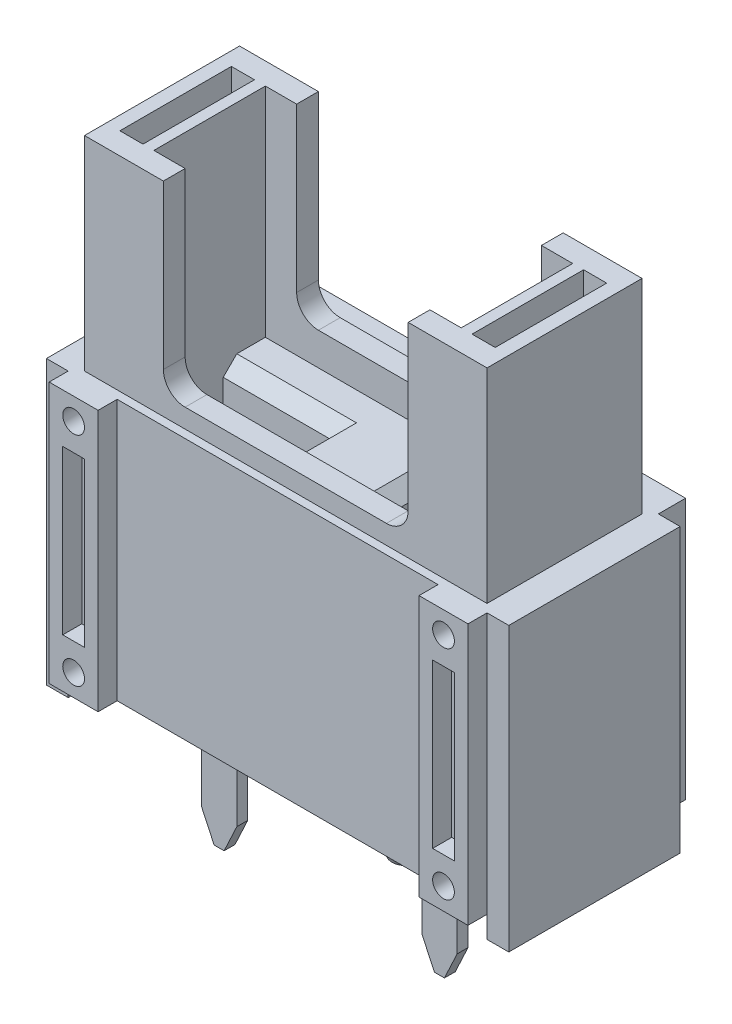
from build123d import *
from OCP.BRepFilletAPI import BRepFilletAPI_MakeChamfer

# Parameters (mm, degrees)
BOSS_EXTRUDE1_DEPTH = 10.4
SKETCH2_W           = 15.4
SKETCH2_H           = 10.496650932
CUT_EXTRUDE1_DEPTH  = 0.8
SKETCH3_W           = 14.8
SKETCH3_H           = 5.7
BOSS_EXTRUDE2_DEPTH = 7.5
CUT_EXTRUDE2_DEPTH  = 26.659501164
SKETCH5_W           = 11.3
SKETCH5_H           = 4.1
CUT_EXTRUDE3_DEPTH  = 8
SKETCH6_W           = 0.85
SKETCH6_H           = 4.1
CUT_EXTRUDE4_DEPTH  = 8
SKETCH7_R           = 0.4
SKETCH7_W           = 0.8
SKETCH7_H           = 6
CUT_EXTRUDE5_DEPTH  = 0.7
SKETCH8_R           = 1.19
BOSS_EXTRUDE3_DEPTH = 4.3
SKETCH9_R           = 2.149416558
SKETCH9_R_2         = 1.05
CUT_EXTRUDE6_DEPTH  = 2.3
CHAMFER1_SIZE       = 1.5
CHAMFER1_SIZE2      = 0.699461487
SKETCH10_W          = 3.754063744
SKETCH10_H          = 0.4
CUT_EXTRUDE7_DEPTH  = 4
SKETCH11_W          = 1.3
SKETCH11_H          = 0.4
BOSS_EXTRUDE4_DEPTH = 4.71
CHAMFER2_SIZE       = 1
CHAMFER2_SIZE2      = 0.466307658
FILLET1_R           = 0.3
CUT_EXTRUDE8_DEPTH  = 0.05
BOSS_EXTRUDE5_DEPTH = 0.05
CUT_EXTRUDE10_DEPTH = 0.03
SKETCH15_R          = 1.45
SKETCH15_R_2        = 1.15
CUT_EXTRUDE11_DEPTH = 0.1
SKETCH16_W          = 3.9
SKETCH16_H          = 1
CUT_EXTRUDE12_DEPTH = 8
CHAMFER3_SIZE       = 0.5


with BuildPart() as part:
    # Sketch1 → Boss-Extrude1 (new body)
    with BuildSketch(Plane(origin=(0, 0, 0), x_dir=(1, 0, 0), z_dir=(0, 1, 0))):
        Polygon((0, 0), (0, 6.3), (0.8, 6.3), (0.8, 7.3), (16.2, 7.3), (16.2, 6.3), (17, 6.3), (17, 0), (16.2, 0), (16.2, -0.7), (14.4, -0.7), (14.4, 0), (2.6, 0), (2.6, -0.7), (0.8, -0.7), (0.8, 0), align=None)
    extrude(amount=BOSS_EXTRUDE1_DEPTH)

    # Sketch2 → Cut-Extrude1 (cut)
    with BuildSketch(Plane.XZ):
        with Locations((8.5, -3.67488039)):
            Rectangle(SKETCH2_W, SKETCH2_H)
    extrude(amount=-CUT_EXTRUDE1_DEPTH, mode=Mode.SUBTRACT)

    # Sketch3 → Boss-Extrude2 (add)
    with BuildSketch(Plane(origin=(0, 10.4, 0), x_dir=(1, 0, 0), z_dir=(0, 1, 0))):
        with Locations((8.5, 3.15)):
            Rectangle(SKETCH3_W, SKETCH3_H)
    extrude(amount=BOSS_EXTRUDE2_DEPTH)

    # Sketch4 → Cut-Extrude2 (cut, through all)
    with BuildSketch(Plane.XY.offset(-0.3)):
        with BuildLine():
            Line((4, 17.9), (4, 11.9))
            ThreePointArc((4, 11.9), (4.234314575, 11.334314575), (4.8, 11.1))
            Line((4.8, 11.1), (12.2, 11.1))
            ThreePointArc((12.2, 11.1), (12.765685425, 11.334314575), (13, 11.9))
            Line((13, 11.9), (13, 17.9))
            Line((13, 17.9), (4, 17.9))
        make_face()
    extrude(amount=-CUT_EXTRUDE2_DEPTH, mode=Mode.SUBTRACT)

    # Sketch5 → Cut-Extrude3 (cut)
    with BuildSketch(Plane(origin=(0, 17.9, 0), x_dir=(1, 0, 0), z_dir=(0, 1, 0))):
        with Locations((8.5, 3.15)):
            Rectangle(SKETCH5_W, SKETCH5_H)
    extrude(amount=-CUT_EXTRUDE3_DEPTH, mode=Mode.SUBTRACT)

    # Sketch6 → Cut-Extrude4 (cut)
    with BuildSketch(Plane(origin=(0, 17.9, 0), x_dir=(1, 0, 0), z_dir=(0, 1, 0))):
        with Locations((14.975, 3.15)):
            Rectangle(SKETCH6_W, SKETCH6_H)
        with Locations((2.025, 3.15)):
            Rectangle(SKETCH6_W, SKETCH6_H)
    extrude(amount=-CUT_EXTRUDE4_DEPTH, mode=Mode.SUBTRACT)

    # Sketch7 → Cut-Extrude5 (cut)
    with BuildSketch(Plane.XY.offset(0.7)):
        with Locations((15.3, 9.6)):
            Circle(SKETCH7_R)
        with Locations((15.3, 1.6)):
            Circle(SKETCH7_R)
        with Locations(Location((1.7, 1.6, 0), (0, 0, 180))):
            Circle(SKETCH7_R)
        with Locations(Location((1.7, 9.6, 0), (0, 0, 180))):
            Circle(SKETCH7_R)
        with Locations((15.3, 5.6)):
            Rectangle(SKETCH7_W, SKETCH7_H)
        with Locations((1.7, 5.6)):
            Rectangle(SKETCH7_W, SKETCH7_H)
    extrude(amount=-CUT_EXTRUDE5_DEPTH, mode=Mode.SUBTRACT)

    # Sketch8 → Boss-Extrude3 (add)
    with BuildSketch(Plane.XZ.offset(-0.8)):
        with Locations(Location((8.5, -4.7, 0), (0, 0, 90))):
            Circle(SKETCH8_R)
    extrude(amount=BOSS_EXTRUDE3_DEPTH)

    # Sketch9 → Cut-Extrude6 (cut)
    with BuildSketch(Plane.XZ.offset(-0.8)):
        with Locations((8.5, -4.7)):
            Circle(SKETCH9_R)
        with Locations(Location((8.5, -4.7, 0), (0, 0, 270))):
            Circle(SKETCH9_R_2, mode=Mode.SUBTRACT)
    extrude(amount=CUT_EXTRUDE6_DEPTH, mode=Mode.SUBTRACT)

    # Chamfer1
    chamfer1_edges = [part.edges().sort_by_distance(p)[0] for p in [
        (8.5, -3.5, -5.89),
    ]]
    chamfer1_side = [part.faces().sort_by_distance(p)[0] for p in [
        (8.5, -2.5, -5.89),
    ]]
    chamfer(chamfer1_edges, length=CHAMFER1_SIZE, length2=CHAMFER1_SIZE2, reference=chamfer1_side[0])

    # Sketch10 → Cut-Extrude7 (cut)
    with BuildSketch(Plane.XZ.offset(3.5)):
        with Locations((8.5, -4.7)):
            Rectangle(SKETCH10_W, SKETCH10_H)
    extrude(amount=-CUT_EXTRUDE7_DEPTH, mode=Mode.SUBTRACT)

    # Sketch11 → Boss-Extrude4 (add)
    with BuildSketch(Plane.XZ.offset(-0.8)):
        with Locations((12.55, -2.1)):
            Rectangle(SKETCH11_W, SKETCH11_H)
        with Locations((4.45, -2.1)):
            Rectangle(SKETCH11_W, SKETCH11_H)
    extrude(amount=BOSS_EXTRUDE4_DEPTH)

    # Chamfer2: one chamfer whose edges measure the first distance from different faces: ONE call of the kernel's chamfer builder (chamfer() names one face for all edges)
    chamfer2_edges_1 = [part.edges().sort_by_distance(p)[0] for p in [
        (13.2, -3.91, -2.1),
    ]]
    chamfer2_side_1 = [part.faces().sort_by_distance(p)[0] for p in [
        (13.2, -1.555, -2.1),
    ]]
    chamfer2_edges_2 = [part.edges().sort_by_distance(p)[0] for p in [
        (11.9, -3.91, -2.1),
    ]]
    chamfer2_side_2 = [part.faces().sort_by_distance(p)[0] for p in [
        (11.9, -1.555, -2.1),
    ]]
    chamfer2_edges_3 = [part.edges().sort_by_distance(p)[0] for p in [
        (5.1, -3.91, -2.1),
    ]]
    chamfer2_side_3 = [part.faces().sort_by_distance(p)[0] for p in [
        (5.1, -1.555, -2.1),
    ]]
    chamfer2_edges_4 = [part.edges().sort_by_distance(p)[0] for p in [
        (3.8, -3.91, -2.1),
    ]]
    chamfer2_side_4 = [part.faces().sort_by_distance(p)[0] for p in [
        (3.8, -1.555, -2.1),
    ]]
    chamfer2 = BRepFilletAPI_MakeChamfer(part.part.solid().wrapped)
    for e in chamfer2_edges_1:
        chamfer2.Add(CHAMFER2_SIZE, CHAMFER2_SIZE2, e.wrapped, chamfer2_side_1[0].wrapped)  # the first distance lies on this face
    for e in chamfer2_edges_2:
        chamfer2.Add(CHAMFER2_SIZE, CHAMFER2_SIZE2, e.wrapped, chamfer2_side_2[0].wrapped)  # the first distance lies on this face
    for e in chamfer2_edges_3:
        chamfer2.Add(CHAMFER2_SIZE, CHAMFER2_SIZE2, e.wrapped, chamfer2_side_3[0].wrapped)  # the first distance lies on this face
    for e in chamfer2_edges_4:
        chamfer2.Add(CHAMFER2_SIZE, CHAMFER2_SIZE2, e.wrapped, chamfer2_side_4[0].wrapped)  # the first distance lies on this face
    add(Compound.cast(chamfer2.Shape()), mode=Mode.REPLACE)

    # Fillet1
    fillet1_edges = [part.edges().sort_by_distance(p)[0] for p in [
        (13.2, 0.8, -2.1),
        (11.9, 0.8, -2.1),
        (5.1, 0.8, -2.1),
        (3.8, 0.8, -2.1),
    ]]
    fillet(fillet1_edges, radius=FILLET1_R)

    # Sketch12 → Cut-Extrude8 (cut)
    with BuildSketch(Plane(origin=(0, 0, -7.3), x_dir=(-1, 0, 0), z_dir=(0, 0, -1))):
        with BuildLine():
            Line((-12, 8.35), (-5, 8.35))
            ThreePointArc((-5, 8.35), (-4.646446609, 8.203553391), (-4.5, 7.85))
            Line((-4.5, 7.85), (-4.5, 3.35))
            ThreePointArc((-4.5, 3.35), (-4.646446609, 2.996446609), (-5, 2.85))
            Line((-5, 2.85), (-12, 2.85))
            ThreePointArc((-12, 2.85), (-12.353553391, 2.996446609), (-12.5, 3.35))
            Line((-12.5, 3.35), (-12.5, 7.85))
            ThreePointArc((-12.5, 7.85), (-12.353553391, 8.203553391), (-12, 8.35))
        make_face()
    extrude(amount=-CUT_EXTRUDE8_DEPTH, mode=Mode.SUBTRACT)

    # Sketch13 → Boss-Extrude5 (add)
    # profile 1 of 9: a face of its own
    with BuildSketch(Plane(origin=(0, 0, -7.25), x_dir=(-1, 0, 0), z_dir=(0, 0, -1))):
        with BuildLine():
            Line((-11.867863065, 6.901428283), (-11.962841698, 6.901428283))
            add(Edge.make_bspline(
                [(-11.962841698, 6.901428283), (-11.960268572, 6.912081915), (-11.955238321, 6.932908894), (-11.944746436, 6.962665376), (-11.933316661, 6.990824155), (-11.91959186, 7.016857968), (-11.904621356, 7.041290017), (-11.887469485, 7.063566157), (-11.868927569, 7.084252934), (-11.848418596, 7.102611461), (-11.826910644, 7.119235679), (-11.804100652, 7.133409804), (-11.780447539, 7.145603059), (-11.755787425, 7.155648225), (-11.730046892, 7.163215466), (-11.703458649, 7.168705739), (-11.675953019, 7.172271147), (-11.657281724, 7.172619116), (-11.647800966, 7.172795805)],
                knots=[0, 0, 0, 0, 1.162005537, 2.271625781, 3.343758855, 4.383309926, 5.390229558, 6.379919256, 7.361854164, 8.333198761, 9.295911338, 10.242430842, 11.177959212, 12.116337295, 13.062827104, 14.020064771, 14.994644689, 16, 16, 16, 16], degree=3))
            add(Edge.make_bspline(
                [(-11.647800966, 7.172795805), (-11.633987375, 7.172378752), (-11.606661507, 7.171553743), (-11.566516491, 7.164020092), (-11.527803619, 7.152098683), (-11.490946632, 7.135626865), (-11.456711535, 7.115310701), (-11.426250831, 7.091130888), (-11.3999774, 7.063553957), (-11.377935529, 7.033094348), (-11.360677136, 7.000541372), (-11.347951019, 6.967037515), (-11.34020351, 6.932662252), (-11.339199437, 6.909452313), (-11.338696399, 6.897824183)],
                knots=[0, 0, 0, 0, 1.083050992, 2.142477498, 3.193116406, 4.255571735, 5.30263384, 6.308962982, 7.297363603, 8.282367274, 9.249857812, 10.179914175, 11.08814088, 12, 12, 12, 12], degree=3))
            add(Edge.make_bspline(
                [(-11.338696399, 6.897824183), (-11.339048246, 6.886634033), (-11.339736758, 6.864736647), (-11.345582902, 6.83276848), (-11.355421248, 6.802638758), (-11.369049486, 6.774220644), (-11.38669086, 6.747694324), (-11.408060937, 6.723000114), (-11.433310551, 6.700028488), (-11.452444897, 6.686869028), (-11.462295824, 6.680094149)],
                knots=[0, 0, 0, 0, 1.024540389, 2.004866551, 2.965041327, 3.920577974, 4.882998113, 5.874504559, 6.905732034, 8, 8, 8, 8], degree=3))
            add(Edge.make_bspline(
                [(-11.462295824, 6.680094149), (-11.451037651, 6.674657892), (-11.428731953, 6.663887095), (-11.398327388, 6.642764045), (-11.370726698, 6.618375102), (-11.355334383, 6.599342442), (-11.347600645, 6.589779645)],
                knots=[0, 0, 0, 0, 1.015518401, 2.012035669, 3.001164323, 4, 4, 4, 4], degree=3))
            add(Edge.make_bspline(
                [(-11.347600645, 6.589779645), (-11.342508144, 6.58280742), (-11.332406535, 6.568977146), (-11.319937695, 6.546741131), (-11.308625892, 6.524258657), (-11.299811421, 6.500927122), (-11.292985513, 6.477016949), (-11.288106284, 6.452487082), (-11.285075175, 6.427317489), (-11.284641092, 6.410289668), (-11.284422894, 6.401730433)],
                knots=[0, 0, 0, 0, 1.025084078, 2.033381695, 3.024893161, 4.013698104, 4.991890475, 5.976764909, 6.982997093, 8, 8, 8, 8], degree=3))
            add(Edge.make_bspline(
                [(-11.284422894, 6.401730433), (-11.284965521, 6.386910827), (-11.286048221, 6.357341356), (-11.295725643, 6.313654952), (-11.310727742, 6.27095105), (-11.332032578, 6.230106992), (-11.357997277, 6.191891972), (-11.388887706, 6.15769985), (-11.424352882, 6.128308843), (-11.463906018, 6.103752417), (-11.506758579, 6.084122474), (-11.552592151, 6.070497961), (-11.600746334, 6.06162429), (-11.63376854, 6.060672737), (-11.650557042, 6.060188967)],
                knots=[0, 0, 0, 0, 0.955779014, 1.907060117, 2.875433937, 3.871313158, 4.872415639, 5.851225146, 6.836215519, 7.83643374, 8.849228613, 9.86973379, 10.916971861, 12, 12, 12, 12], degree=3))
            add(Edge.make_bspline(
                [(-11.650557042, 6.060188967), (-11.661871926, 6.060451498), (-11.684135844, 6.060968072), (-11.716866616, 6.064499458), (-11.74810913, 6.070949246), (-11.777905627, 6.079628578), (-11.806282579, 6.090632748), (-11.833153392, 6.104336259), (-11.858683383, 6.120456642), (-11.882631638, 6.139184179), (-11.9049953, 6.160133537), (-11.925180052, 6.183676618), (-11.943522418, 6.209378214), (-11.959531263, 6.237536853), (-11.973935771, 6.267788633), (-11.985783346, 6.300520917), (-11.996211125, 6.335441085), (-12.001059339, 6.359776021), (-12.003546826, 6.372261616)],
                knots=[0, 0, 0, 0, 1.048658725, 2.063410685, 3.046034179, 4.001477787, 4.936774919, 5.862367409, 6.792675028, 7.730719943, 8.675894397, 9.627829632, 10.600096036, 11.597688215, 12.626045268, 13.701542398, 14.82072376, 16, 16, 16, 16], degree=3))
            Line((-12.003546826, 6.372261616), (-11.908568194, 6.372261616))
            add(Edge.make_bspline(
                [(-11.908568194, 6.372261616), (-11.906093722, 6.364112748), (-11.90128066, 6.348262492), (-11.893087861, 6.32545078), (-11.883753883, 6.304538702), (-11.873740671, 6.285372853), (-11.863224332, 6.267764484), (-11.851457199, 6.252179204), (-11.839310815, 6.237932465), (-11.830154915, 6.22990588), (-11.825673896, 6.225977562)],
                knots=[0, 0, 0, 0, 1.198163088, 2.33053128, 3.407730985, 4.417276592, 5.372219308, 6.28897303, 7.162600585, 8, 8, 8, 8], degree=3))
            add(Edge.make_bspline(
                [(-11.825673896, 6.225977562), (-11.819748265, 6.22140909), (-11.807915293, 6.212286247), (-11.788632994, 6.200644088), (-11.76835385, 6.190556349), (-11.74663846, 6.182850565), (-11.723955423, 6.176325891), (-11.6999381, 6.172056115), (-11.674798385, 6.169126597), (-11.657632894, 6.168868082), (-11.648860995, 6.168735975)],
                knots=[0, 0, 0, 0, 0.946170439, 1.889420265, 2.845303464, 3.807233317, 4.801018734, 5.828864929, 6.890507805, 8, 8, 8, 8], degree=3))
            add(Edge.make_bspline(
                [(-11.648860995, 6.168735975), (-11.63895696, 6.168922213), (-11.619590474, 6.169286386), (-11.591331505, 6.172635469), (-11.564447586, 6.177512998), (-11.539237201, 6.18504621), (-11.515370119, 6.194353753), (-11.493180906, 6.206040295), (-11.472378274, 6.219751675), (-11.453228668, 6.235336135), (-11.436009431, 6.25239692), (-11.420848198, 6.270241349), (-11.407959312, 6.288794183), (-11.397562373, 6.308158091), (-11.389352563, 6.328252886), (-11.383763596, 6.349134961), (-11.379877542, 6.37063342), (-11.379561067, 6.38524718), (-11.379401527, 6.392614181)],
                knots=[0, 0, 0, 0, 1.217147791, 2.380027433, 3.494444702, 4.572153297, 5.609568379, 6.639424714, 7.649109417, 8.668170816, 9.669597737, 10.625200337, 11.543417969, 12.441394052, 13.322311151, 14.205496177, 15.095365482, 16, 16, 16, 16], degree=3))
            add(Edge.make_bspline(
                [(-11.379401527, 6.392614181), (-11.379864261, 6.402475228), (-11.380787426, 6.422148256), (-11.387835497, 6.451091428), (-11.399428439, 6.478978031), (-11.415657984, 6.505332282), (-11.435414264, 6.529757376), (-11.458505557, 6.551550419), (-11.485123617, 6.569533042), (-11.509622482, 6.581957469), (-11.531322898, 6.590435347), (-11.549893741, 6.5960823), (-11.570684428, 6.600864049), (-11.593443538, 6.605312759), (-11.618342559, 6.609098976), (-11.645354381, 6.612256383), (-11.674484481, 6.614782788), (-11.694650619, 6.615911), (-11.705042553, 6.616492386)],
                knots=[0, 0, 0, 0, 1.07054697, 2.135767047, 3.216561865, 4.33974944, 5.486079747, 6.621378074, 7.775625952, 8.963672916, 9.598146892, 10.304877434, 11.070270905, 11.915000392, 12.823868403, 13.805723172, 14.86925407, 16, 16, 16, 16], degree=3))
            Line((-11.705042553, 6.616492386), (-11.705042553, 6.725039394))
            add(Edge.make_bspline(
                [(-11.705042553, 6.725039394), (-11.691949105, 6.725261585), (-11.666302257, 6.725696802), (-11.628838979, 6.730960653), (-11.593014906, 6.738242176), (-11.559623963, 6.749395555), (-11.529189709, 6.762349645), (-11.502785925, 6.777424004), (-11.480782525, 6.794180368), (-11.463286439, 6.812877372), (-11.45012403, 6.832929779), (-11.440500213, 6.85382934), (-11.434815352, 6.875759234), (-11.434056477, 6.890725479), (-11.433675031, 6.898248195)],
                knots=[0, 0, 0, 0, 1.321986639, 2.589447074, 3.816329219, 5.01088745, 6.139805852, 7.153945165, 8.075214402, 8.924034688, 9.728124013, 10.488707548, 11.240355623, 12, 12, 12, 12], degree=3))
            add(Edge.make_bspline(
                [(-11.433675031, 6.898248195), (-11.433800341, 6.903775037), (-11.434049639, 6.914770427), (-11.437193578, 6.930834436), (-11.441917991, 6.946407341), (-11.448413052, 6.961422917), (-11.457106564, 6.975777024), (-11.467510279, 6.989592038), (-11.479898252, 7.002789085), (-11.494093661, 7.015090039), (-11.509337231, 7.026813118), (-11.52604371, 7.036765575), (-11.543709372, 7.045276106), (-11.562353775, 7.052294217), (-11.582037424, 7.057573573), (-11.602667835, 7.061364173), (-11.624284349, 7.06373413), (-11.639031992, 7.064075342), (-11.646528931, 7.064248796)],
                knots=[0, 0, 0, 0, 0.884392785, 1.759457502, 2.611959086, 3.489218968, 4.37281399, 5.2945488, 6.255912374, 7.266815255, 8.301784654, 9.332968512, 10.37626691, 11.440494194, 12.520033166, 13.637162961, 14.798855837, 16, 16, 16, 16], degree=3))
            add(Edge.make_bspline(
                [(-11.646528931, 7.064248796), (-11.658579316, 7.063828075), (-11.682116521, 7.063006308), (-11.716048175, 7.05580873), (-11.747592354, 7.044324881), (-11.771703808, 7.030617039), (-11.789508777, 7.017085361), (-11.802232042, 7.005267591), (-11.814726577, 6.992134333), (-11.826170389, 6.976876681), (-11.83774371, 6.960527914), (-11.848280042, 6.942256943), (-11.858518568, 6.922540376), (-11.86468791, 6.908601935), (-11.867863065, 6.901428283)],
                knots=[0, 0, 0, 0, 1.472543308, 2.876219568, 4.221790263, 5.565193594, 6.249813518, 6.953379497, 7.687249741, 8.463570142, 9.283606569, 10.136032583, 11.040678096, 12, 12, 12, 12], degree=3))
        make_face()
    # profile 2 of 9: a face of its own
    with BuildSketch(Plane(origin=(0, 0, -7.25), x_dir=(-1, 0, 0), z_dir=(0, 0, -1))):
        with BuildLine():
            Line((-11.053760501, 6.820018027), (-11.148739134, 6.820018027))
            add(Edge.make_bspline(
                [(-11.148739134, 6.820018027), (-11.148120114, 6.832618509), (-11.146904375, 6.857365522), (-11.141211059, 6.893446799), (-11.133064651, 6.927934797), (-11.12154652, 6.960552605), (-11.107242003, 6.991588625), (-11.090087923, 7.020919582), (-11.069769783, 7.048433584), (-11.046726318, 7.073875568), (-11.021698658, 7.097215619), (-10.994694243, 7.117370895), (-10.966317294, 7.134400286), (-10.936653905, 7.148636757), (-10.905369401, 7.159322853), (-10.87274768, 7.167251777), (-10.838645417, 7.172022244), (-10.815410458, 7.172535017), (-10.803593567, 7.172795805)],
                knots=[0, 0, 0, 0, 1.10065271, 2.161652631, 3.183658789, 4.190468796, 5.17591951, 6.163126047, 7.15150782, 8.156236427, 9.156009102, 10.134482811, 11.092018607, 12.041330605, 13.001268258, 13.972401359, 14.968799086, 16, 16, 16, 16], degree=3))
            add(Edge.make_bspline(
                [(-10.803593567, 7.172795805), (-10.791988769, 7.172524128), (-10.769185754, 7.171990295), (-10.735905097, 7.167405888), (-10.704222439, 7.160225673), (-10.67419971, 7.150151726), (-10.646076448, 7.136609768), (-10.619641384, 7.120342417), (-10.594579806, 7.101528325), (-10.572020135, 7.079377768), (-10.551304597, 7.055730856), (-10.533433201, 7.030485704), (-10.518128744, 7.004411611), (-10.505371993, 6.97730975), (-10.495981209, 6.948924939), (-10.488851608, 6.919670428), (-10.484821652, 6.889243401), (-10.484203154, 6.868649276), (-10.483888706, 6.858179084)],
                knots=[0, 0, 0, 0, 1.111607364, 2.184268762, 3.212621178, 4.221274766, 5.211760367, 6.196651075, 7.1921475, 8.207485113, 9.220403448, 10.201281604, 11.166441695, 12.114753415, 13.065576456, 14.026450734, 14.996634279, 16, 16, 16, 16], degree=3))
            add(Edge.make_bspline(
                [(-10.483888706, 6.858179084), (-10.484400717, 6.843438668), (-10.485415753, 6.814216508), (-10.494098433, 6.771273918), (-10.507659164, 6.729668289), (-10.523986936, 6.696183439), (-10.540458366, 6.66920093), (-10.555301493, 6.646985393), (-10.572677757, 6.623065406), (-10.592840065, 6.597521068), (-10.615371338, 6.570152294), (-10.640475659, 6.540975618), (-10.668332045, 6.510292488), (-10.687883544, 6.489335794), (-10.698014641, 6.47847656)],
                knots=[0, 0, 0, 0, 1.184426356, 2.348067706, 3.509069118, 4.696110526, 5.333549288, 6.050745305, 6.844228056, 7.710549037, 8.667450064, 9.695053472, 10.805634456, 12, 12, 12, 12], degree=3))
            Line((-10.698014641, 6.47847656), (-10.96280998, 6.195872728))
            Line((-10.96280998, 6.195872728), (-10.47032033, 6.195872728))
            Line((-10.47032033, 6.195872728), (-10.47032033, 6.087325719))
            Line((-10.47032033, 6.087325719), (-11.189444262, 6.087325719))
            Line((-11.189444262, 6.087325719), (-10.779000886, 6.525329859))
            add(Edge.make_bspline(
                [(-10.779000886, 6.525329859), (-10.769007834, 6.53576149), (-10.749813228, 6.555798518), (-10.722664687, 6.585051746), (-10.698280992, 6.612190298), (-10.676504305, 6.637162897), (-10.65780703, 6.660334823), (-10.641214713, 6.680955603), (-10.627920355, 6.699931353), (-10.613492129, 6.721926729), (-10.599517901, 6.748781882), (-10.587509641, 6.781600403), (-10.580187532, 6.815384596), (-10.579309165, 6.838214974), (-10.578867339, 6.849698849)],
                knots=[0, 0, 0, 0, 1.329631726, 2.553950428, 3.673215718, 4.687767853, 5.603093632, 6.413772471, 7.123043292, 7.734684054, 8.834405432, 9.900288307, 10.943827018, 12, 12, 12, 12], degree=3))
            add(Edge.make_bspline(
                [(-10.578867339, 6.849698849), (-10.579059575, 6.856920129), (-10.579438436, 6.871151886), (-10.582782073, 6.892017913), (-10.587835012, 6.912145844), (-10.595075602, 6.931597594), (-10.604632878, 6.950177588), (-10.616266495, 6.967908446), (-10.629689205, 6.985050109), (-10.645216851, 7.001122654), (-10.66227462, 7.015842923), (-10.680294786, 7.028882825), (-10.699359936, 7.039780366), (-10.719389688, 7.048713756), (-10.740328199, 7.05572155), (-10.762215967, 7.060577359), (-10.784992515, 7.06362611), (-10.800545024, 7.06403861), (-10.808469703, 7.064248796)],
                knots=[0, 0, 0, 0, 0.991446411, 1.95395049, 2.89581595, 3.838931463, 4.798493298, 5.75982156, 6.748411868, 7.785213223, 8.824556874, 9.840280684, 10.836137867, 11.835679398, 12.848801643, 13.863922112, 14.911575587, 16, 16, 16, 16], degree=3))
            add(Edge.make_bspline(
                [(-10.808469703, 7.064248796), (-10.816746121, 7.064032584), (-10.83299964, 7.063607979), (-10.856863253, 7.060637792), (-10.879628238, 7.055513693), (-10.901351861, 7.048505508), (-10.922070879, 7.039597804), (-10.94168453, 7.028502919), (-10.960148785, 7.015263625), (-10.977498352, 7.000253266), (-10.993483413, 6.983541396), (-11.007528063, 6.964911717), (-11.019799896, 6.94470438), (-11.030506974, 6.922973908), (-11.039202147, 6.899523123), (-11.045846409, 6.874435269), (-11.05110386, 6.84781928), (-11.052860246, 6.829439028), (-11.053760501, 6.820018027)],
                knots=[0, 0, 0, 0, 1.031018746, 2.02475058, 2.990194455, 3.934040569, 4.864654155, 5.795059489, 6.735614925, 7.690564532, 8.649604399, 9.611025574, 10.590972636, 11.591080095, 12.624614302, 13.701020113, 14.821632451, 16, 16, 16, 16], degree=3))
        make_face()
    # profile 3 of 9: a face of its own
    with BuildSketch(Plane(origin=(0, 0, -7.25), x_dir=(-1, 0, 0), z_dir=(0, 0, -1))):
        Polygon((-10.361773322, 7.145659052), (-10.260010501, 7.145659052), (-9.907232723, 6.311627936), (-9.554454946, 7.145659052), (-9.452692125, 7.145659052), (-9.900448535, 6.087325719), (-9.914016911, 6.087325719), align=None)
    # profile 4 of 9: a face of its own
    with BuildSketch(Plane(origin=(0, 0, -7.25), x_dir=(-1, 0, 0), z_dir=(0, 0, -1))):
        with BuildLine():
            Line((-7.593824604, 6.820018027), (-7.688803236, 6.820018027))
            add(Edge.make_bspline(
                [(-7.688803236, 6.820018027), (-7.688184216, 6.832618509), (-7.686968477, 6.857365522), (-7.681275161, 6.893446799), (-7.673128753, 6.927934797), (-7.661610623, 6.960552605), (-7.647306106, 6.991588625), (-7.630152026, 7.020919582), (-7.609833885, 7.048433584), (-7.586790421, 7.073875568), (-7.561762761, 7.097215619), (-7.534758346, 7.117370895), (-7.506381397, 7.134400286), (-7.476718007, 7.148636757), (-7.445433504, 7.159322853), (-7.412811782, 7.167251777), (-7.37870952, 7.172022244), (-7.35547456, 7.172535017), (-7.34365767, 7.172795805)],
                knots=[0, 0, 0, 0, 1.10065271, 2.161652631, 3.183658789, 4.190468796, 5.17591951, 6.163126047, 7.15150782, 8.156236427, 9.156009102, 10.134482811, 11.092018607, 12.041330605, 13.001268258, 13.972401359, 14.968799086, 16, 16, 16, 16], degree=3))
            add(Edge.make_bspline(
                [(-7.34365767, 7.172795805), (-7.332052871, 7.172524128), (-7.309249857, 7.171990295), (-7.2759692, 7.167405888), (-7.244286542, 7.160225673), (-7.214263813, 7.150151726), (-7.18614055, 7.136609768), (-7.159705487, 7.120342417), (-7.134643908, 7.101528325), (-7.112084238, 7.079377768), (-7.0913687, 7.055730856), (-7.073497303, 7.030485704), (-7.058192847, 7.004411611), (-7.045436096, 6.97730975), (-7.036045311, 6.948924939), (-7.02891571, 6.919670428), (-7.024885754, 6.889243401), (-7.024267257, 6.868649276), (-7.023952809, 6.858179084)],
                knots=[0, 0, 0, 0, 1.111607364, 2.184268762, 3.212621178, 4.221274766, 5.211760367, 6.196651075, 7.1921475, 8.207485113, 9.220403448, 10.201281604, 11.166441695, 12.114753415, 13.065576456, 14.026450734, 14.996634279, 16, 16, 16, 16], degree=3))
            add(Edge.make_bspline(
                [(-7.023952809, 6.858179084), (-7.024464819, 6.843438668), (-7.025479855, 6.814216508), (-7.034162536, 6.771273918), (-7.047723266, 6.729668289), (-7.064051039, 6.696183439), (-7.080522468, 6.66920093), (-7.095365595, 6.646985393), (-7.11274186, 6.623065406), (-7.132904167, 6.597521068), (-7.155435441, 6.570152294), (-7.180539762, 6.540975618), (-7.208396148, 6.510292488), (-7.227947647, 6.489335794), (-7.238078744, 6.47847656)],
                knots=[0, 0, 0, 0, 1.184426356, 2.348067706, 3.509069118, 4.696110526, 5.333549288, 6.050745305, 6.844228056, 7.710549037, 8.667450064, 9.695053472, 10.805634456, 12, 12, 12, 12], degree=3))
            Line((-7.238078744, 6.47847656), (-7.502874083, 6.195872728))
            Line((-7.502874083, 6.195872728), (-7.010384433, 6.195872728))
            Line((-7.010384433, 6.195872728), (-7.010384433, 6.087325719))
            Line((-7.010384433, 6.087325719), (-7.729508364, 6.087325719))
            Line((-7.729508364, 6.087325719), (-7.319064988, 6.525329859))
            add(Edge.make_bspline(
                [(-7.319064988, 6.525329859), (-7.309071937, 6.53576149), (-7.28987733, 6.555798518), (-7.262728789, 6.585051746), (-7.238345095, 6.612190298), (-7.216568407, 6.637162897), (-7.197871133, 6.660334823), (-7.181278815, 6.680955603), (-7.167984458, 6.699931353), (-7.153556231, 6.721926729), (-7.139582003, 6.748781882), (-7.127573743, 6.781600403), (-7.120251634, 6.815384596), (-7.119373268, 6.838214974), (-7.118931441, 6.849698849)],
                knots=[0, 0, 0, 0, 1.329631726, 2.553950428, 3.673215718, 4.687767853, 5.603093632, 6.413772471, 7.123043292, 7.734684054, 8.834405432, 9.900288307, 10.943827018, 12, 12, 12, 12], degree=3))
            add(Edge.make_bspline(
                [(-7.118931441, 6.849698849), (-7.119123678, 6.856920129), (-7.119502539, 6.871151886), (-7.122846176, 6.892017913), (-7.127899115, 6.912145844), (-7.135139705, 6.931597594), (-7.144696981, 6.950177588), (-7.156330598, 6.967908446), (-7.169753308, 6.985050109), (-7.185280953, 7.001122654), (-7.202338722, 7.015842923), (-7.220358888, 7.028882825), (-7.239424039, 7.039780366), (-7.25945379, 7.048713756), (-7.280392301, 7.05572155), (-7.302280069, 7.060577359), (-7.325056617, 7.06362611), (-7.340609126, 7.06403861), (-7.348533805, 7.064248796)],
                knots=[0, 0, 0, 0, 0.991446411, 1.95395049, 2.89581595, 3.838931463, 4.798493298, 5.75982156, 6.748411868, 7.785213223, 8.824556874, 9.840280684, 10.836137867, 11.835679398, 12.848801643, 13.863922112, 14.911575587, 16, 16, 16, 16], degree=3))
            add(Edge.make_bspline(
                [(-7.348533805, 7.064248796), (-7.356810224, 7.064032584), (-7.373063743, 7.063607979), (-7.396927355, 7.060637792), (-7.41969234, 7.055513693), (-7.441415963, 7.048505508), (-7.462134981, 7.039597804), (-7.481748633, 7.028502919), (-7.500212887, 7.015263625), (-7.517562455, 7.000253266), (-7.533547515, 6.983541396), (-7.547592166, 6.964911717), (-7.559863999, 6.94470438), (-7.570571076, 6.922973908), (-7.579266249, 6.899523123), (-7.585910511, 6.874435269), (-7.591167963, 6.84781928), (-7.592924349, 6.829439028), (-7.593824604, 6.820018027)],
                knots=[0, 0, 0, 0, 1.031018746, 2.02475058, 2.990194455, 3.934040569, 4.864654155, 5.795059489, 6.735614925, 7.690564532, 8.649604399, 9.611025574, 10.590972636, 11.591080095, 12.624614302, 13.701020113, 14.821632451, 16, 16, 16, 16], degree=3))
        make_face()
    # profile 5 of 9: a face of its own
    with BuildSketch(Plane(origin=(0, 0, -7.25), x_dir=(-1, 0, 0), z_dir=(0, 0, -1))):
        with BuildLine():
            add(Edge.make_bspline(
                [(-6.9154058, 6.616068374), (-6.915306614, 6.633031155), (-6.915113943, 6.665981603), (-6.912970539, 6.713995054), (-6.9094099, 6.759037808), (-6.904530266, 6.801112021), (-6.898592115, 6.840228555), (-6.890665051, 6.876282874), (-6.881650227, 6.909441851), (-6.871202226, 6.939813613), (-6.859413061, 6.967807347), (-6.846581749, 6.993940681), (-6.832199061, 7.018174075), (-6.817086995, 7.040894312), (-6.800633821, 7.061729477), (-6.783307758, 7.080973806), (-6.764432571, 7.098182533), (-6.7446499, 7.113859867), (-6.723780636, 7.127602921), (-6.702419639, 7.139708059), (-6.680419881, 7.150049448), (-6.657721297, 7.158180603), (-6.634527904, 7.16489674), (-6.610758625, 7.169489589), (-6.586374212, 7.172379416), (-6.569915183, 7.172655691), (-6.561567993, 7.172795805)],
                knots=[0, 0, 0, 0, 1.646270934, 3.197905019, 4.663502075, 6.030701355, 7.308322542, 8.50163776, 9.611534131, 10.641858119, 11.616356847, 12.558055219, 13.465016945, 14.349605745, 15.204443733, 16.039544428, 16.859896111, 17.680448484, 18.487036065, 19.28249412, 20.06191084, 20.843045899, 21.620316918, 22.403196591, 23.190181807, 24, 24, 24, 24], degree=3))
            add(Edge.make_bspline(
                [(-6.561567993, 7.172795805), (-6.553151075, 7.172648298), (-6.536412472, 7.172354955), (-6.511665501, 7.169535573), (-6.487490241, 7.1648574), (-6.463989756, 7.158228915), (-6.44097101, 7.15000546), (-6.418614048, 7.139698165), (-6.396780002, 7.127700031), (-6.375815844, 7.113601859), (-6.355491425, 7.097883409), (-6.336305969, 7.080114697), (-6.318257731, 7.060475139), (-6.301120198, 7.039174861), (-6.285379577, 7.015805324), (-6.270389516, 6.990772986), (-6.256972257, 6.963640081), (-6.244050105, 6.934859321), (-6.232896183, 6.903634357), (-6.222837104, 6.870141204), (-6.214709416, 6.833984247), (-6.207939327, 6.795353192), (-6.202694561, 6.754106167), (-6.19887469, 6.710331591), (-6.196856876, 6.664000663), (-6.196476874, 6.632323885), (-6.196281869, 6.616068374)],
                knots=[0, 0, 0, 0, 0.810914788, 1.612654377, 2.396697861, 3.181598691, 3.963628158, 4.749916497, 5.551656086, 6.361998678, 7.18212741, 8.025565596, 8.878627764, 9.750805457, 10.657531673, 11.591944965, 12.560506719, 13.57287815, 14.630710178, 15.753379473, 16.941251878, 18.199788006, 19.531962791, 20.947069417, 22.433333509, 24, 24, 24, 24], degree=3))
            add(Edge.make_bspline(
                [(-6.196281869, 6.616068374), (-6.196478896, 6.599883764), (-6.196862794, 6.568348711), (-6.19885207, 6.522226249), (-6.202770513, 6.478683984), (-6.207672105, 6.437617487), (-6.214460848, 6.399197683), (-6.222808125, 6.363291623), (-6.232076199, 6.329744249), (-6.24351672, 6.29883039), (-6.25603853, 6.270118797), (-6.269662363, 6.24330754), (-6.284258239, 6.218159638), (-6.300160074, 6.194876381), (-6.317109558, 6.173292835), (-6.335469461, 6.153789982), (-6.354722233, 6.135897898), (-6.375106463, 6.119977049), (-6.396397575, 6.106041882), (-6.41815663, 6.093579598), (-6.4407697, 6.083530664), (-6.463724331, 6.074902211), (-6.487348861, 6.06831017), (-6.511613841, 6.063752123), (-6.536395846, 6.060555398), (-6.553148224, 6.060311533), (-6.561567993, 6.060188967)],
                knots=[0, 0, 0, 0, 1.561518951, 3.042555995, 4.452378317, 5.7783523, 7.031515105, 8.214008947, 9.334062868, 10.386615937, 11.391082383, 12.354592575, 13.286541444, 14.194233754, 15.072674879, 15.931287219, 16.775624067, 17.606195743, 18.42308326, 19.229000347, 20.022332153, 20.807536673, 21.593273796, 22.3848459, 23.188221202, 24, 24, 24, 24], degree=3))
            add(Edge.make_bspline(
                [(-6.561567993, 6.060188967), (-6.569914952, 6.060329984), (-6.586373524, 6.060608042), (-6.610761281, 6.063484813), (-6.634432401, 6.068109882), (-6.657503691, 6.074585855), (-6.680093518, 6.082512722), (-6.701894062, 6.092840146), (-6.723147719, 6.104734019), (-6.743797784, 6.118279301), (-6.763456224, 6.133798), (-6.782233659, 6.15096244), (-6.799658367, 6.170200948), (-6.815876296, 6.191209748), (-6.831289889, 6.213795562), (-6.845468343, 6.238266761), (-6.858582863, 6.264526312), (-6.870570299, 6.292743871), (-6.881198586, 6.323331194), (-6.890586821, 6.356638208), (-6.897999436, 6.392958888), (-6.904344282, 6.43200152), (-6.909461893, 6.473933876), (-6.912955701, 6.518778718), (-6.915115098, 6.566508103), (-6.915307131, 6.59924682), (-6.9154058, 6.616068374)],
                knots=[0, 0, 0, 0, 0.810891512, 1.598919785, 2.382837074, 3.152667961, 3.926044502, 4.706494248, 5.493654104, 6.291793342, 7.103789334, 7.925228297, 8.761435821, 9.622817696, 10.50288917, 11.416980706, 12.369136599, 13.353924996, 14.394355917, 15.514179734, 16.714354668, 17.994756427, 19.357759367, 20.818452758, 22.365282078, 24, 24, 24, 24], degree=3))
        make_face()
        with BuildLine():
            add(Edge.make_bspline(
                [(-6.820427168, 6.616492386), (-6.820391049, 6.60235647), (-6.82032095, 6.574921432), (-6.818489671, 6.535054541), (-6.815994958, 6.497870656), (-6.812777232, 6.463322563), (-6.807998722, 6.431527202), (-6.802644526, 6.402265893), (-6.796128794, 6.375693491), (-6.788419587, 6.351627653), (-6.779638717, 6.329659958), (-6.770051467, 6.309218638), (-6.759752154, 6.290062219), (-6.748225649, 6.272362771), (-6.735672284, 6.256062574), (-6.722375608, 6.240873122), (-6.707839374, 6.227327368), (-6.687729909, 6.211081391), (-6.661181928, 6.194293462), (-6.627732409, 6.179674526), (-6.593361235, 6.170487449), (-6.570032166, 6.169319123), (-6.558387905, 6.168735975)],
                knots=[0, 0, 0, 0, 1.459021318, 2.831673884, 4.118529203, 5.306027144, 6.411944654, 7.436330062, 8.375795394, 9.233974572, 10.042671642, 10.816086306, 11.563610507, 12.285937304, 12.993564865, 13.685989202, 14.367179055, 15.041617293, 16.353048772, 17.594441528, 18.799311195, 20, 20, 20, 20], degree=3))
            add(Edge.make_bspline(
                [(-6.558387905, 6.168735975), (-6.546668323, 6.169219114), (-6.523253357, 6.170184393), (-6.489043852, 6.179497345), (-6.45583327, 6.193548849), (-6.429806755, 6.210163928), (-6.410006081, 6.225987018), (-6.395819277, 6.239477638), (-6.382798134, 6.25458334), (-6.370448268, 6.270881461), (-6.359121357, 6.288683378), (-6.348821313, 6.307903491), (-6.339422301, 6.328595171), (-6.334067423, 6.34303983), (-6.331329612, 6.350425011)],
                knots=[0, 0, 0, 0, 1.353760809, 2.704726607, 4.075137775, 5.516104923, 6.260822281, 7.007110065, 7.778089737, 8.566572457, 9.372053459, 10.217411131, 11.088608312, 12, 12, 12, 12], degree=3))
            add(Edge.make_bspline(
                [(-6.331329612, 6.350425011), (-6.328138958, 6.35986829), (-6.321660563, 6.379042195), (-6.313311288, 6.408785489), (-6.306735894, 6.439992039), (-6.300820305, 6.472475348), (-6.296782595, 6.506474972), (-6.293532661, 6.541885712), (-6.291618382, 6.578734267), (-6.291381088, 6.603769895), (-6.291260501, 6.616492386)],
                knots=[0, 0, 0, 0, 0.884706709, 1.796334032, 2.740027952, 3.714592787, 4.726048262, 5.777819803, 6.87074269, 8, 8, 8, 8], degree=3))
            add(Edge.make_bspline(
                [(-6.291260501, 6.616492386), (-6.291426868, 6.629212818), (-6.291752317, 6.654096704), (-6.292996308, 6.690539106), (-6.296208675, 6.725151977), (-6.299776504, 6.758084429), (-6.305037092, 6.789154164), (-6.310709096, 6.81862128), (-6.318329462, 6.846120718), (-6.326469489, 6.87208302), (-6.335785966, 6.896213218), (-6.346041438, 6.918623815), (-6.356994208, 6.939423006), (-6.368890552, 6.958553724), (-6.381589247, 6.97610166), (-6.395425458, 6.991714978), (-6.409850352, 7.005877585), (-6.430054596, 7.022043647), (-6.456505155, 7.038526945), (-6.489418006, 7.053696116), (-6.523668891, 7.062407195), (-6.546823245, 7.063635371), (-6.558387905, 7.064248796)],
                knots=[0, 0, 0, 0, 1.31362396, 2.569729283, 3.763502607, 4.902122613, 5.988968491, 7.01645872, 7.998833611, 8.933434873, 9.825090667, 10.667526885, 11.477055099, 12.250526234, 12.991942729, 13.710640831, 14.402115721, 15.076753259, 16.378508321, 17.609869233, 18.806226677, 20, 20, 20, 20], degree=3))
            add(Edge.make_bspline(
                [(-6.558387905, 7.064248796), (-6.570093251, 7.063634525), (-6.593525267, 7.062404865), (-6.628132148, 7.053728571), (-6.661304654, 7.038605603), (-6.687685268, 7.021989052), (-6.707903604, 7.006162944), (-6.722140513, 6.992438945), (-6.735489475, 6.977426863), (-6.747786613, 6.96097676), (-6.759304087, 6.943297947), (-6.769881678, 6.924251344), (-6.779411919, 6.903740431), (-6.788206528, 6.881782605), (-6.795939252, 6.857718843), (-6.802317665, 6.831179171), (-6.808210179, 6.802010932), (-6.812381605, 6.770043367), (-6.816089931, 6.73548662), (-6.818473101, 6.698209907), (-6.820327076, 6.658276154), (-6.820393136, 6.630699266), (-6.820427168, 6.616492386)],
                knots=[0, 0, 0, 0, 1.207732386, 2.417664972, 3.655092373, 4.956220595, 5.625982001, 6.301752483, 6.994047911, 7.697131622, 8.419323945, 9.170223765, 9.943494443, 10.752040957, 11.610060368, 12.549350801, 13.567764191, 14.679664412, 15.874934091, 17.154273443, 18.533957287, 20, 20, 20, 20], degree=3))
        make_face(mode=Mode.SUBTRACT)
    # profile 6 of 9: a face of its own
    with BuildSketch(Plane(origin=(0, 0, -7.25), x_dir=(-1, 0, 0), z_dir=(0, 0, -1))):
        Polygon((-5.57213657, 7.145659052), (-5.083675031, 6.087325719), (-5.186921893, 6.087325719), (-5.343382229, 6.426535121), (-5.823151527, 6.426535121), (-5.984063987, 6.087325719), (-6.08773486, 6.087325719), (-5.585704946, 7.145659052), align=None)
        Polygon((-5.579980787, 6.939377335), (-5.771634099, 6.535082129), (-5.393415616, 6.535082129), align=None, mode=Mode.SUBTRACT)
    # profile 7 of 9: a face of its own
    with BuildSketch(Plane(origin=(0, 0, -7.25), x_dir=(-1, 0, 0), z_dir=(0, 0, -1))):
        Polygon((-7.892328877, 3.32343683), (-7.752617005, 4.381770163), (-7.739048629, 4.381770163), (-7.302104518, 3.513394095), (-6.866220437, 4.381770163), (-6.852440055, 4.381770163), (-6.711880159, 3.32343683), (-6.807282804, 3.32343683), (-6.908621612, 4.084961937), (-7.290656201, 3.32343683), (-7.312068795, 3.32343683), (-7.695587424, 4.086657984), (-7.796714227, 3.32343683), align=None)
    # profile 8 of 9: a face of its own
    with BuildSketch(Plane(origin=(0, 0, -7.25), x_dir=(-1, 0, 0), z_dir=(0, 0, -1))):
        Polygon((-6.060598108, 4.381770163), (-5.57213657, 3.32343683), (-5.675383431, 3.32343683), (-5.831843768, 3.662646232), (-6.311613065, 3.662646232), (-6.472525525, 3.32343683), (-6.576196399, 3.32343683), (-6.074166484, 4.381770163), align=None)
        Polygon((-6.068442325, 4.175488446), (-6.260095637, 3.77119324), (-5.881877155, 3.77119324), align=None, mode=Mode.SUBTRACT)
    # profile 9 of 9: a face of its own
    with BuildSketch(Plane(origin=(0, 0, -7.25), x_dir=(-1, 0, 0), z_dir=(0, 0, -1))):
        Polygon((-5.456805373, 4.381770163), (-5.347198335, 4.381770163), (-5.070106655, 3.948854165), (-4.793014975, 4.381770163), (-4.683407937, 4.381770163), (-5.015197133, 3.863203791), (-4.669839561, 3.32343683), (-4.779446599, 3.32343683), (-5.070106655, 3.777553417), (-5.360766711, 3.32343683), (-5.470373749, 3.32343683), (-5.124804171, 3.863203791), align=None)
    extrude(amount=BOSS_EXTRUDE5_DEPTH)

    # Sketch14 → Cut-Extrude10 (cut)
    with BuildSketch(Plane(origin=(0, 0, -7.3), x_dir=(-1, 0, 0), z_dir=(0, 0, -1))):
        Polygon((-9.617479351, 2.347952139), (-9.421797928, 2.347952139), (-9.421797928, 1.289618805), (-9.51677656, 1.289618805), (-9.51677656, 2.23940513), (-9.679597073, 2.23940513), align=None)
        with BuildLine():
            Line((-8.363464594, 2.347952139), (-8.363464594, 2.23940513))
            Line((-8.363464594, 2.23940513), (-8.723450572, 2.23940513))
            Line((-8.723450572, 2.23940513), (-8.780480152, 1.961041415))
            add(Edge.make_bspline(
                [(-8.780480152, 1.961041415), (-8.769275162, 1.964134854), (-8.747567265, 1.970127904), (-8.715527021, 1.976782029), (-8.685109855, 1.980793247), (-8.665371826, 1.981340953), (-8.655820697, 1.981605985)],
                knots=[0, 0, 0, 0, 1.100273476, 2.13160584, 3.095893838, 4, 4, 4, 4], degree=3))
            add(Edge.make_bspline(
                [(-8.655820697, 1.981605985), (-8.644002519, 1.98135019), (-8.620765027, 1.980847233), (-8.586765631, 1.97601765), (-8.554310209, 1.968415819), (-8.523466635, 1.957796042), (-8.49417785, 1.944216194), (-8.466713325, 1.927252641), (-8.440660813, 1.90743661), (-8.416487696, 1.884653713), (-8.394557726, 1.859579796), (-8.375276105, 1.832620154), (-8.35889837, 1.80403679), (-8.345726427, 1.773556605), (-8.335208307, 1.741516576), (-8.328207585, 1.707579581), (-8.323545866, 1.672065506), (-8.323025049, 1.647782934), (-8.322759466, 1.635400389)],
                knots=[0, 0, 0, 0, 1.052922333, 2.070308379, 3.05430497, 4.020497103, 4.973039431, 5.925935799, 6.892292201, 7.88610001, 8.88166317, 9.857072816, 10.836096531, 11.812156883, 12.81219415, 13.836441305, 14.89672472, 16, 16, 16, 16], degree=3))
            add(Edge.make_bspline(
                [(-8.322759466, 1.635400389), (-8.322960572, 1.626775813), (-8.323360066, 1.609643214), (-8.325391639, 1.584199611), (-8.329303154, 1.559294659), (-8.334554823, 1.534925055), (-8.34137122, 1.511136935), (-8.34962291, 1.487862211), (-8.359721233, 1.465245747), (-8.370797863, 1.443073544), (-8.383270012, 1.421846853), (-8.397112561, 1.401995849), (-8.411737364, 1.383222745), (-8.427473688, 1.365728878), (-8.444467799, 1.349629204), (-8.462513884, 1.334828176), (-8.481467944, 1.321075488), (-8.50162322, 1.308929391), (-8.52253059, 1.297752497), (-8.544491979, 1.288583237), (-8.567007477, 1.28038553), (-8.590401141, 1.27385122), (-8.614619985, 1.268731138), (-8.639703929, 1.265253576), (-8.665521417, 1.2627207), (-8.683021718, 1.262562145), (-8.691861696, 1.262482053)],
                knots=[0, 0, 0, 0, 1.056347294, 2.098418968, 3.122841568, 4.141288669, 5.149314143, 6.15115421, 7.162517403, 8.180376062, 9.185164535, 10.17417709, 11.141909838, 12.097768115, 13.052685741, 14.0056014, 14.954263652, 15.917497458, 16.885230207, 17.854509472, 18.828990115, 19.81800267, 20.826176721, 21.857883937, 22.917946725, 24, 24, 24, 24], degree=3))
            add(Edge.make_bspline(
                [(-8.691861696, 1.262482053), (-8.702406984, 1.262690949), (-8.723153593, 1.263101928), (-8.753549097, 1.267401327), (-8.782793752, 1.273558988), (-8.81065214, 1.282822812), (-8.837373927, 1.294430399), (-8.862599367, 1.309100765), (-8.886973019, 1.325725399), (-8.909504039, 1.345343982), (-8.930415531, 1.366787533), (-8.94913488, 1.390058058), (-8.965806223, 1.414771485), (-8.98016259, 1.441047831), (-8.99240842, 1.468818054), (-9.002028666, 1.498186199), (-9.009793312, 1.528998819), (-9.013078203, 1.550211905), (-9.014746645, 1.560986327)],
                knots=[0, 0, 0, 0, 1.0467383, 2.05933395, 3.04377827, 4.011590433, 4.970194871, 5.932262533, 6.905835911, 7.896367577, 8.894135286, 9.877477877, 10.858688626, 11.851381753, 12.8477658, 13.868841284, 14.917554742, 16, 16, 16, 16], degree=3))
            Line((-9.014746645, 1.560986327), (-8.919768013, 1.560986327))
            add(Edge.make_bspline(
                [(-8.919768013, 1.560986327), (-8.917431044, 1.550893923), (-8.912939261, 1.531495763), (-8.903079904, 1.504241763), (-8.891025222, 1.479954759), (-8.87669105, 1.45831348), (-8.859591398, 1.439442188), (-8.840078928, 1.422624648), (-8.818202355, 1.407452645), (-8.793892973, 1.394806237), (-8.768247114, 1.384020685), (-8.7414056, 1.376838625), (-8.714099286, 1.371788593), (-8.69563035, 1.371283084), (-8.686349543, 1.371029062)],
                knots=[0, 0, 0, 0, 1.136247022, 2.183929868, 3.172523383, 4.106158343, 5.02341133, 5.958108904, 6.928429099, 7.938127109, 8.96079061, 9.975095812, 10.982467395, 12, 12, 12, 12], degree=3))
            add(Edge.make_bspline(
                [(-8.686349543, 1.371029062), (-8.67729068, 1.371277249), (-8.659453705, 1.371765933), (-8.633203595, 1.375527253), (-8.607860179, 1.381320138), (-8.583673526, 1.389989356), (-8.560220393, 1.400525735), (-8.538094039, 1.414046722), (-8.516654359, 1.429607252), (-8.496567757, 1.447434614), (-8.478171067, 1.467080212), (-8.461916239, 1.488088852), (-8.448376554, 1.510500375), (-8.436966478, 1.53392678), (-8.428302266, 1.55862482), (-8.422121303, 1.584478747), (-8.418491806, 1.61155242), (-8.417992521, 1.630018616), (-8.417738098, 1.639428501)],
                knots=[0, 0, 0, 0, 1.027316725, 2.022795036, 3.002884548, 3.971462791, 4.93288096, 5.914575861, 6.907176829, 7.935150275, 8.956128384, 9.956726525, 10.942570165, 11.921478529, 12.907843606, 13.90538589, 14.932640048, 16, 16, 16, 16], degree=3))
            add(Edge.make_bspline(
                [(-8.417738098, 1.639428501), (-8.41793721, 1.647918073), (-8.418326943, 1.664535204), (-8.421511187, 1.688846392), (-8.42704989, 1.711849431), (-8.434737587, 1.733655402), (-8.444498296, 1.754284871), (-8.456426109, 1.77375913), (-8.470744875, 1.791821504), (-8.487101231, 1.808480442), (-8.505019734, 1.823854964), (-8.524808675, 1.83696139), (-8.546053939, 1.847987384), (-8.568499556, 1.857502708), (-8.592679418, 1.864336743), (-8.618114686, 1.869467508), (-8.645080024, 1.872435487), (-8.663516398, 1.872847296), (-8.672993173, 1.873058976)],
                knots=[0, 0, 0, 0, 1.045622112, 2.046656509, 3.013763289, 3.955457236, 4.890082067, 5.820317437, 6.762574623, 7.722996705, 8.69280354, 9.665887285, 10.63943826, 11.638615906, 12.663482002, 13.728887084, 14.832589034, 16, 16, 16, 16], degree=3))
            add(Edge.make_bspline(
                [(-8.672993173, 1.873058976), (-8.681196445, 1.872883417), (-8.698134119, 1.87252093), (-8.724115545, 1.869851966), (-8.751418042, 1.865546274), (-8.779936949, 1.859623766), (-8.809757912, 1.851873417), (-8.840818, 1.842585937), (-8.873182519, 1.831481904), (-8.894989545, 1.823096211), (-8.906199637, 1.818785472)],
                knots=[0, 0, 0, 0, 0.817624296, 1.688186739, 2.600797293, 3.572016777, 4.590301741, 5.671205678, 6.80286297, 8, 8, 8, 8], degree=3))
            Line((-8.906199637, 1.818785472), (-8.797652628, 2.347952139))
            Line((-8.797652628, 2.347952139), (-8.363464594, 2.347952139))
        make_face()
        with BuildLine():
            Line((-8.078528697, 2.103721369), (-8.173507329, 2.103721369))
            add(Edge.make_bspline(
                [(-8.173507329, 2.103721369), (-8.170934203, 2.114375002), (-8.165903952, 2.135201981), (-8.155412067, 2.164958462), (-8.143982292, 2.193117241), (-8.130257491, 2.219151054), (-8.115286987, 2.243583103), (-8.098135117, 2.265859243), (-8.079593201, 2.286546021), (-8.059084228, 2.304904547), (-8.037576275, 2.321528765), (-8.014766283, 2.33570289), (-7.99111317, 2.347896146), (-7.966453056, 2.357941311), (-7.940712523, 2.365508553), (-7.91412428, 2.370998825), (-7.88661865, 2.374564233), (-7.867947355, 2.374912202), (-7.858466597, 2.375088891)],
                knots=[0, 0, 0, 0, 1.162005537, 2.271625781, 3.343758855, 4.383309926, 5.390229558, 6.379919256, 7.361854164, 8.333198761, 9.295911338, 10.242430842, 11.177959212, 12.116337295, 13.062827104, 14.020064771, 14.994644689, 16, 16, 16, 16], degree=3))
            add(Edge.make_bspline(
                [(-7.858466597, 2.375088891), (-7.844653006, 2.374671838), (-7.817327139, 2.373846829), (-7.777182122, 2.366313178), (-7.738469251, 2.354391769), (-7.701612264, 2.337919952), (-7.667377166, 2.317603788), (-7.636916462, 2.293423974), (-7.610643032, 2.265847043), (-7.58860116, 2.235387434), (-7.571342768, 2.202834459), (-7.55861665, 2.169330602), (-7.550869142, 2.134955339), (-7.549865069, 2.1117454), (-7.54936203, 2.10011727)],
                knots=[0, 0, 0, 0, 1.083050992, 2.142477498, 3.193116406, 4.255571735, 5.30263384, 6.308962982, 7.297363603, 8.282367274, 9.249857812, 10.179914175, 11.08814088, 12, 12, 12, 12], degree=3))
            add(Edge.make_bspline(
                [(-7.54936203, 2.10011727), (-7.549713878, 2.08892712), (-7.550402389, 2.067029733), (-7.556248534, 2.035061566), (-7.56608688, 2.004931844), (-7.579715118, 1.976513731), (-7.597356491, 1.94998741), (-7.618726568, 1.9252932), (-7.643976183, 1.902321574), (-7.663110528, 1.889162114), (-7.672961456, 1.882387235)],
                knots=[0, 0, 0, 0, 1.024540389, 2.004866551, 2.965041327, 3.920577974, 4.882998113, 5.874504559, 6.905732034, 8, 8, 8, 8], degree=3))
            add(Edge.make_bspline(
                [(-7.672961456, 1.882387235), (-7.661703282, 1.876950978), (-7.639397585, 1.866180182), (-7.60899302, 1.845057131), (-7.581392329, 1.820668188), (-7.566000014, 1.801635529), (-7.558266277, 1.792072732)],
                knots=[0, 0, 0, 0, 1.015518401, 2.012035669, 3.001164323, 4, 4, 4, 4], degree=3))
            add(Edge.make_bspline(
                [(-7.558266277, 1.792072732), (-7.553173776, 1.785100507), (-7.543072167, 1.771270232), (-7.530603327, 1.749034218), (-7.519291523, 1.726551743), (-7.510477052, 1.703220209), (-7.503651145, 1.679310036), (-7.498771916, 1.654780168), (-7.495740807, 1.629610576), (-7.495306723, 1.612582754), (-7.495088526, 1.60402352)],
                knots=[0, 0, 0, 0, 1.025084078, 2.033381695, 3.024893161, 4.013698104, 4.991890475, 5.976764909, 6.982997093, 8, 8, 8, 8], degree=3))
            add(Edge.make_bspline(
                [(-7.495088526, 1.60402352), (-7.495631153, 1.589203913), (-7.496713852, 1.559634442), (-7.506391275, 1.515948038), (-7.521393374, 1.473244137), (-7.542698209, 1.432400078), (-7.568662908, 1.394185058), (-7.599553337, 1.359992936), (-7.635018513, 1.33060193), (-7.67457165, 1.306045503), (-7.71742421, 1.28641556), (-7.763257782, 1.272791048), (-7.811411965, 1.263917376), (-7.844434172, 1.262965823), (-7.861222674, 1.262482053)],
                knots=[0, 0, 0, 0, 0.955779014, 1.907060117, 2.875433937, 3.871313158, 4.872415639, 5.851225146, 6.836215519, 7.83643374, 8.849228613, 9.86973379, 10.916971861, 12, 12, 12, 12], degree=3))
            add(Edge.make_bspline(
                [(-7.861222674, 1.262482053), (-7.872537557, 1.262744584), (-7.894801475, 1.263261158), (-7.927532248, 1.266792545), (-7.958774761, 1.273242332), (-7.988571259, 1.281921665), (-8.01694821, 1.292925834), (-8.043819023, 1.306629346), (-8.069349015, 1.322749728), (-8.093297269, 1.341477266), (-8.115660931, 1.362426623), (-8.135845683, 1.385969705), (-8.154188049, 1.411671301), (-8.170196895, 1.439829939), (-8.184601402, 1.470081719), (-8.196448977, 1.502814003), (-8.206876756, 1.537734172), (-8.21172497, 1.562069107), (-8.214212457, 1.574554703)],
                knots=[0, 0, 0, 0, 1.048658725, 2.063410685, 3.046034179, 4.001477787, 4.936774919, 5.862367409, 6.792675028, 7.730719943, 8.675894397, 9.627829632, 10.600096036, 11.597688215, 12.626045268, 13.701542398, 14.82072376, 16, 16, 16, 16], degree=3))
            Line((-8.214212457, 1.574554703), (-8.119233825, 1.574554703))
            add(Edge.make_bspline(
                [(-8.119233825, 1.574554703), (-8.116759353, 1.566405835), (-8.111946292, 1.550555578), (-8.103753492, 1.527743866), (-8.094419514, 1.506831788), (-8.084406303, 1.48766594), (-8.073889963, 1.47005757), (-8.062122831, 1.454472291), (-8.049976447, 1.440225551), (-8.040820547, 1.432198966), (-8.036339527, 1.428270648)],
                knots=[0, 0, 0, 0, 1.198163088, 2.33053128, 3.407730985, 4.417276592, 5.372219308, 6.28897303, 7.162600585, 8, 8, 8, 8], degree=3))
            add(Edge.make_bspline(
                [(-8.036339527, 1.428270648), (-8.030413896, 1.423702176), (-8.018580924, 1.414579333), (-7.999298626, 1.402937174), (-7.979019481, 1.392849435), (-7.957304092, 1.385143651), (-7.934621054, 1.378618977), (-7.910603732, 1.374349201), (-7.885464016, 1.371419683), (-7.868298526, 1.371161168), (-7.859526627, 1.371029062)],
                knots=[0, 0, 0, 0, 0.946170439, 1.889420265, 2.845303464, 3.807233317, 4.801018734, 5.828864929, 6.890507805, 8, 8, 8, 8], degree=3))
            add(Edge.make_bspline(
                [(-7.859526627, 1.371029062), (-7.849622591, 1.3712153), (-7.830256105, 1.371579472), (-7.801997136, 1.374928555), (-7.775113217, 1.379806085), (-7.749902833, 1.387339296), (-7.726035751, 1.396646839), (-7.703846538, 1.408333381), (-7.683043905, 1.422044761), (-7.663894299, 1.437629221), (-7.646675063, 1.454690006), (-7.631513829, 1.472534435), (-7.618624943, 1.491087269), (-7.608228004, 1.510451177), (-7.600018195, 1.530545973), (-7.594429227, 1.551428047), (-7.590543174, 1.572926506), (-7.590226698, 1.587540266), (-7.590067158, 1.594907267)],
                knots=[0, 0, 0, 0, 1.217147791, 2.380027433, 3.494444702, 4.572153297, 5.609568379, 6.639424714, 7.649109417, 8.668170816, 9.669597737, 10.625200337, 11.543417969, 12.441394052, 13.322311151, 14.205496177, 15.095365482, 16, 16, 16, 16], degree=3))
            add(Edge.make_bspline(
                [(-7.590067158, 1.594907267), (-7.590529892, 1.604768315), (-7.591453058, 1.624441343), (-7.598501128, 1.653384514), (-7.610094071, 1.681271117), (-7.626323616, 1.707625368), (-7.646079896, 1.732050462), (-7.669171189, 1.753843506), (-7.695789248, 1.771826129), (-7.720288114, 1.784250556), (-7.74198853, 1.792728433), (-7.760559372, 1.798375387), (-7.78135006, 1.803157135), (-7.80410917, 1.807605846), (-7.82900819, 1.811392063), (-7.856020013, 1.814549469), (-7.885150112, 1.817075874), (-7.90531625, 1.818204086), (-7.915708184, 1.818785472)],
                knots=[0, 0, 0, 0, 1.07054697, 2.135767047, 3.216561865, 4.33974944, 5.486079747, 6.621378074, 7.775625952, 8.963672916, 9.598146892, 10.304877434, 11.070270905, 11.915000392, 12.823868403, 13.805723172, 14.86925407, 16, 16, 16, 16], degree=3))
            Line((-7.915708184, 1.818785472), (-7.915708184, 1.927332481))
            add(Edge.make_bspline(
                [(-7.915708184, 1.927332481), (-7.902614736, 1.927554671), (-7.876967889, 1.927989888), (-7.839504611, 1.933253739), (-7.803680538, 1.940535262), (-7.770289594, 1.951688642), (-7.739855341, 1.964642731), (-7.713451556, 1.97971709), (-7.691448157, 1.996473455), (-7.673952071, 2.015170458), (-7.660789661, 2.035222865), (-7.651165844, 2.056122426), (-7.645480983, 2.078052321), (-7.644722108, 2.093018565), (-7.644340663, 2.100541281)],
                knots=[0, 0, 0, 0, 1.321986639, 2.589447074, 3.816329219, 5.01088745, 6.139805852, 7.153945165, 8.075214402, 8.924034688, 9.728124013, 10.488707548, 11.240355623, 12, 12, 12, 12], degree=3))
            add(Edge.make_bspline(
                [(-7.644340663, 2.100541281), (-7.644465973, 2.106068123), (-7.644715271, 2.117063513), (-7.64785921, 2.133127522), (-7.652583622, 2.148700427), (-7.659078683, 2.163716003), (-7.667772195, 2.17807011), (-7.67817591, 2.191885124), (-7.690563884, 2.205082172), (-7.704759293, 2.217383125), (-7.720002862, 2.229106204), (-7.736709342, 2.239058661), (-7.754375004, 2.247569192), (-7.773019407, 2.254587303), (-7.792703055, 2.259866659), (-7.813333467, 2.263657259), (-7.83494998, 2.266027217), (-7.849697623, 2.266368428), (-7.857194562, 2.266541882)],
                knots=[0, 0, 0, 0, 0.884392785, 1.759457502, 2.611959086, 3.489218968, 4.37281399, 5.2945488, 6.255912374, 7.266815255, 8.301784654, 9.332968512, 10.37626691, 11.440494194, 12.520033166, 13.637162961, 14.798855837, 16, 16, 16, 16], degree=3))
            add(Edge.make_bspline(
                [(-7.857194562, 2.266541882), (-7.869244947, 2.266121161), (-7.892782153, 2.265299394), (-7.926713806, 2.258101816), (-7.958257986, 2.246617967), (-7.98236944, 2.232910126), (-8.000174409, 2.219378447), (-8.012897673, 2.207560678), (-8.025392208, 2.194427419), (-8.03683602, 2.179169768), (-8.048409342, 2.162821), (-8.058945673, 2.14455003), (-8.069184199, 2.124833463), (-8.075353542, 2.110895021), (-8.078528697, 2.103721369)],
                knots=[0, 0, 0, 0, 1.472543308, 2.876219568, 4.221790263, 5.565193594, 6.249813518, 6.953379497, 7.687249741, 8.463570142, 9.283606569, 10.136032583, 11.040678096, 12, 12, 12, 12], degree=3))
        make_face()
    extrude(amount=-CUT_EXTRUDE10_DEPTH, mode=Mode.SUBTRACT)

    # Sketch15 → Cut-Extrude11 (cut)
    # profile 1 of 2: a face of its own
    with BuildSketch(Plane.XZ.offset(-0.8)):
        with Locations(Location((4.45, -2.1, 0), (0, 0, 270))):
            Circle(SKETCH15_R)
        with Locations(Location((4.45, -2.1, 0), (0, 0, 270))):
            Circle(SKETCH15_R_2, mode=Mode.SUBTRACT)
    # profile 2 of 2: a face of its own
    with BuildSketch(Plane.XZ.offset(-0.8)):
        with Locations(Location((12.55, -2.1, 0), (0, 0, 270))):
            Circle(SKETCH15_R)
        with Locations(Location((12.55, -2.1, 0), (0, 0, 270))):
            Circle(SKETCH15_R_2, mode=Mode.SUBTRACT)
    extrude(amount=-CUT_EXTRUDE11_DEPTH, mode=Mode.SUBTRACT)

    # Sketch16 → Cut-Extrude12 (cut)
    with BuildSketch(Plane(origin=(0, 9.9, 0), x_dir=(1, 0, 0), z_dir=(0, 1, 0))):
        with Locations((4.8, 3.15)):
            Rectangle(SKETCH16_W, SKETCH16_H)
        with Locations((12.2, 3.15)):
            Rectangle(SKETCH16_W, SKETCH16_H)
    extrude(amount=-CUT_EXTRUDE12_DEPTH, mode=Mode.SUBTRACT)

    # Chamfer3
    chamfer3_edges = [part.edges().sort_by_distance(p)[0] for p in [
        (12.2, 9.9, -2.65),
        (10.25, 9.9, -3.15),
        (12.2, 9.9, -3.65),
        (4.8, 9.9, -2.65),
        (6.75, 9.9, -3.15),
        (4.8, 9.9, -3.65),
    ]]
    chamfer(chamfer3_edges, length=CHAMFER3_SIZE)


solid = part.part
